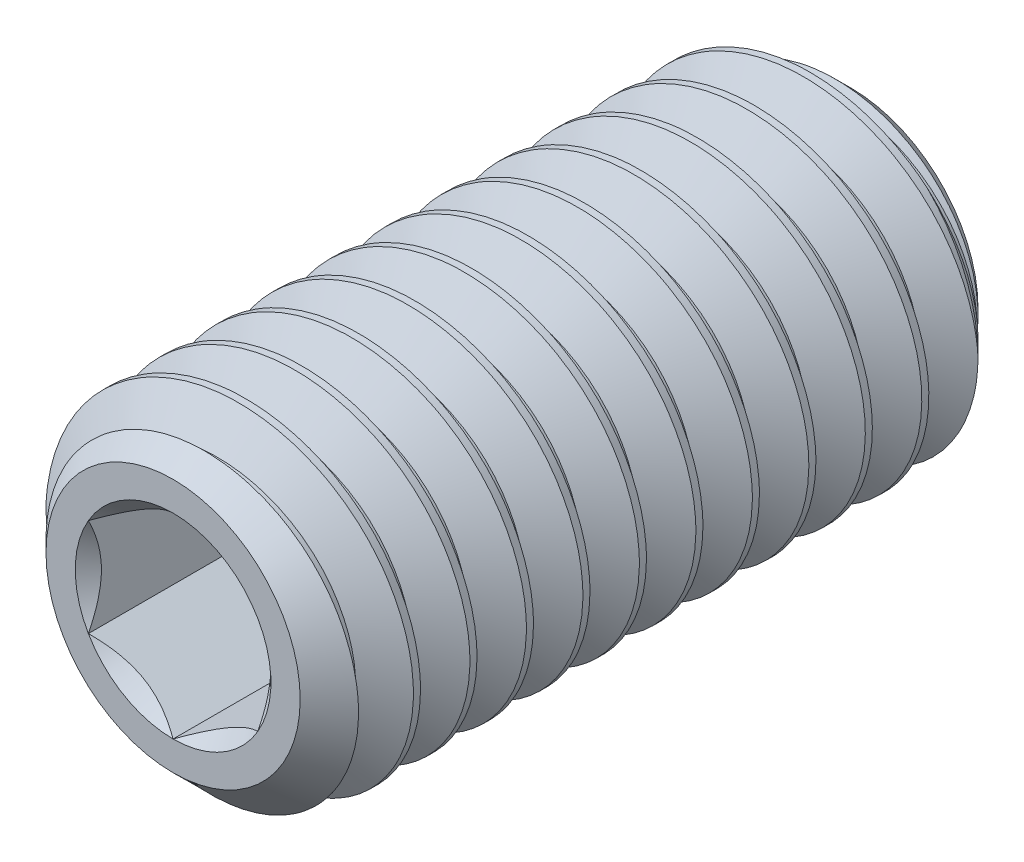
from build123d import *

# Parameters (mm, degrees)
SKETCH2_W              = 6
SKETCH2_H              = 1.5
CHAMFER1_SIZE          = 0.375
CUT_EXTRUDE1_DEPTH     = 2.628
CUT_SWEEP1_PITCH       = 0.5
CUT_SWEEP1_HEIGHT      = 6.5
CUT_SWEEP1_RADIUS      = 1.5
CUT_SWEEP1_START_ANGLE = 90


with BuildPart() as part:
    # Sketch2 → Revolve1 (revolve)
    with BuildSketch(Plane(origin=(0, 0, 0), x_dir=(0, 0, -1), z_dir=(1, 0, 0)), mode=Mode.PRIVATE) as revolve1_sk:
        with Locations((0, 0.75)):
            Rectangle(SKETCH2_W, SKETCH2_H)
    revolve(revolve1_sk.sketch.rotate(Axis((0, 0, 3), (0, 0, -1)), 180), axis=Axis((0, 0, 3), (0, 0, -1)))

    # Chamfer1
    chamfer1_edges = [part.edges().sort_by_distance(p)[0] for p in [
        (0, 1.5, -3),
        (0, 1.5, 3),
    ]]
    chamfer(chamfer1_edges, length=CHAMFER1_SIZE)

    # Sketch3 → Cut-Extrude1 (cut)
    with BuildSketch(Plane.XY.offset(3)):
        Polygon((0, 0.866025404), (-0.75, 0.433012702), (-0.75, -0.433012702), (0, -0.866025404), (0.75, -0.433012702), (0.75, 0.433012702), align=None)
    extrude(amount=-CUT_EXTRUDE1_DEPTH, mode=Mode.SUBTRACT)

    # Cut-Extrude2 cone 1 section (through the dimple's axis) → Cut-Extrude2 (revolve, cut)
    with BuildSketch(Plane(origin=(0, 0, 3), x_dir=(0, -1, 0), z_dir=(1, 0, 0))):
        Polygon((0, 0), (0.866025404, 0), (0, 0.866025404), align=None)
    revolve(axis=Axis((0, 0, 3), (0, 0, -1)), mode=Mode.SUBTRACT)

    # Cut-Sweep1: sweep along a helix
    with BuildLine() as cut_sweep1_path:
        add(Helix(CUT_SWEEP1_PITCH, CUT_SWEEP1_HEIGHT, CUT_SWEEP1_RADIUS, center=(0, 0, 3), direction=(0, 0, -1), mode=Mode.PRIVATE).rotate(Axis((0, 0, 3), (0, 0, -1)), CUT_SWEEP1_START_ANGLE))
    # Sketch6 → Cut-Sweep1 (sweep, cut)
    with BuildSketch(Plane(origin=(0, 0, 0), x_dir=(0, 0, -1), z_dir=(1, 0, 0))):
        Polygon((-3.453125, 1.527063294), (-2.984375, 1.527063294), (-3.1875, 1.175240474), (-3.25, 1.175240474), align=None)
    sweep(path=cut_sweep1_path.line, is_frenet=True, mode=Mode.SUBTRACT)


solid = part.part
